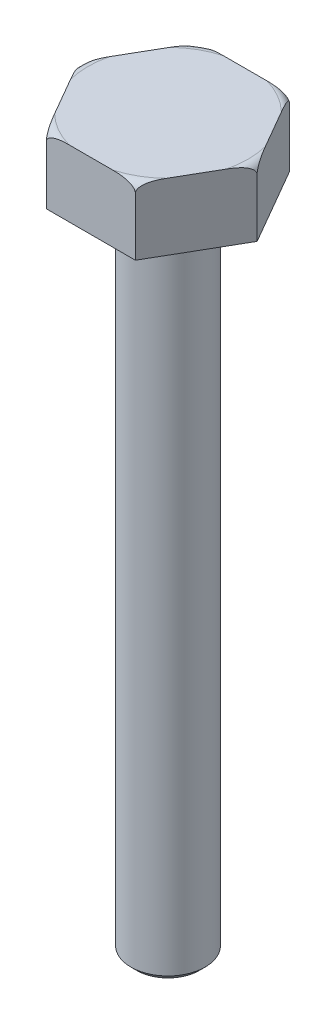
from build123d import *

# Parameters (mm, degrees)
SKETCH1_R           = 25
BOSS_EXTRUDE1_DEPTH = 445
SKETCH2_R           = 25
BOSS_EXTRUDE2_DEPTH = 45
CHAMFER1_SIZE       = 4


with BuildPart() as part:
    # Sketch1 → Boss-Extrude1 (new body)
    with BuildSketch(Plane(origin=(0, 0, 0), x_dir=(1, 0, 0), z_dir=(0, 1, 0))):
        with Locations(Location((0, 0, 0), (0, 0, 270))):
            Circle(SKETCH1_R)
    extrude(amount=BOSS_EXTRUDE1_DEPTH)

    # Sketch2 → Boss-Extrude2 (add)
    with BuildSketch(Plane(origin=(0, 445, 0), x_dir=(1, 0, 0), z_dir=(0, 1, 0))):
        with Locations(Location((0, 0, 0), (0, 0, 270))):
            Circle(SKETCH2_R)
        Polygon((-30.022213998, -52), (30.022213998, -52), (60.044427996, 0), (-60.044427996, 0), align=None)
        with BuildLine():
            ThreePointArc((-25, 0), (0, -25), (25, 0))
            Line((25, 0), (-25, 0))
        make_face()
        with BuildLine():
            Line((-25, 0), (25, 0))
            ThreePointArc((25, 0), (0, 25), (-25, 0))
        make_face()
        Polygon((-60.044427996, 0), (60.044427996, 0), (30.022213998, 52), (-30.022213998, 52), align=None)
    extrude(amount=BOSS_EXTRUDE2_DEPTH)

    # Chamfer1
    chamfer1_edges = [part.edges().sort_by_distance(p)[0] for p in [
        (0, 0, -25),
    ]]
    chamfer(chamfer1_edges, length=CHAMFER1_SIZE)

    # Sketch4 → Cut-Revolve1 (revolve, cut)
    with BuildSketch(Plane.XY):
        with BuildLine():
            Line((54.044427996, 490), (54.044427996, 495.946588309))
            Line((54.044427996, 495.946588309), (66.888539308, 495.946588309))
            Line((66.888539308, 495.946588309), (66.888539308, 484))
            Line((66.888539308, 484), (60.044427996, 484))
            ThreePointArc((60.044427996, 484), (58.287068683, 488.242640687), (54.044427996, 490))
        make_face()
    revolve(axis=Axis((0, 0, 0), (0, 1, 0)), mode=Mode.SUBTRACT)


solid = part.part
